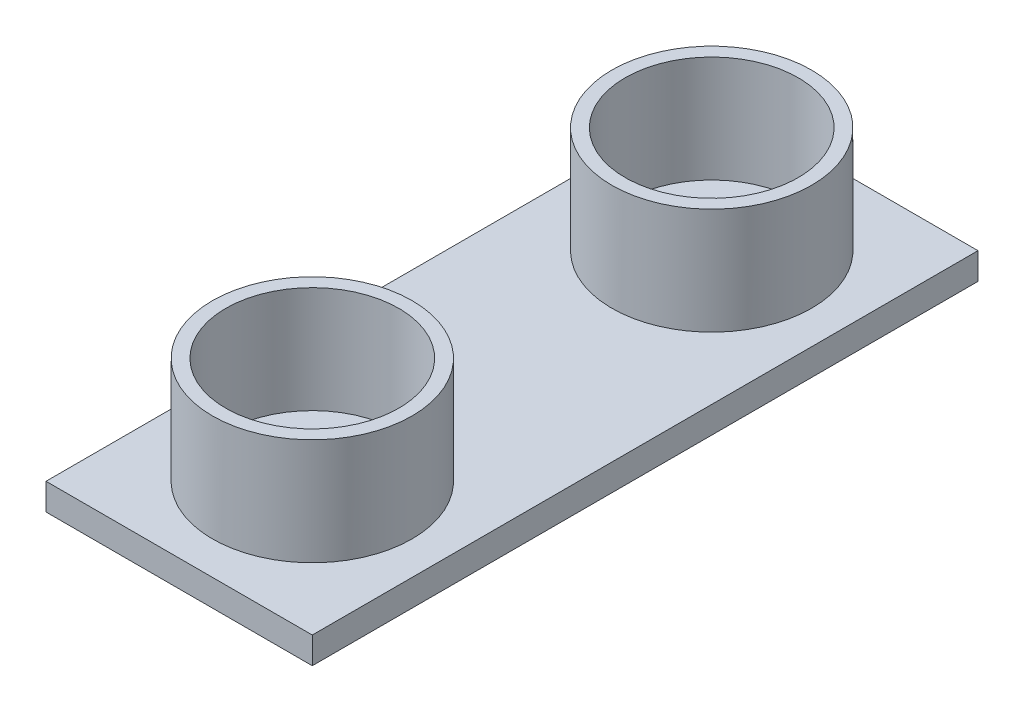
from build123d import *

# Parameters (mm, degrees)
SKETCH1_W           = 2
SKETCH1_H           = 0.2
BOSS_EXTRUDE1_DEPTH = 5
SKETCH2_R           = 0.75
SKETCH2_R_2         = 0.65
BOSS_EXTRUDE2_DEPTH = 0.8


with BuildPart() as part:
    # Sketch1 → Boss-Extrude1 (new body)
    with BuildSketch(Plane.XY):
        Rectangle(SKETCH1_W, SKETCH1_H)
    extrude(amount=BOSS_EXTRUDE1_DEPTH)

    # Sketch2 → Boss-Extrude2 (add)
    # profile 1 of 2: a face of its own
    with BuildSketch(Plane(origin=(0, 0.1, 0), x_dir=(1, 0, 0), z_dir=(0, 1, 0))):
        with Locations((0, -1)):
            Circle(SKETCH2_R)
        with Locations(Location((0, -1, 0), (0, 0, 180))):
            Circle(SKETCH2_R_2, mode=Mode.SUBTRACT)
    # profile 2 of 2: a face of its own
    with BuildSketch(Plane(origin=(0, 0.1, 0), x_dir=(1, 0, 0), z_dir=(0, 1, 0))):
        with Locations((0, -4)):
            Circle(SKETCH2_R)
        with Locations(Location((0, -4, 0), (0, 0, 180))):
            Circle(SKETCH2_R_2, mode=Mode.SUBTRACT)
    extrude(amount=BOSS_EXTRUDE2_DEPTH)


solid = part.part
